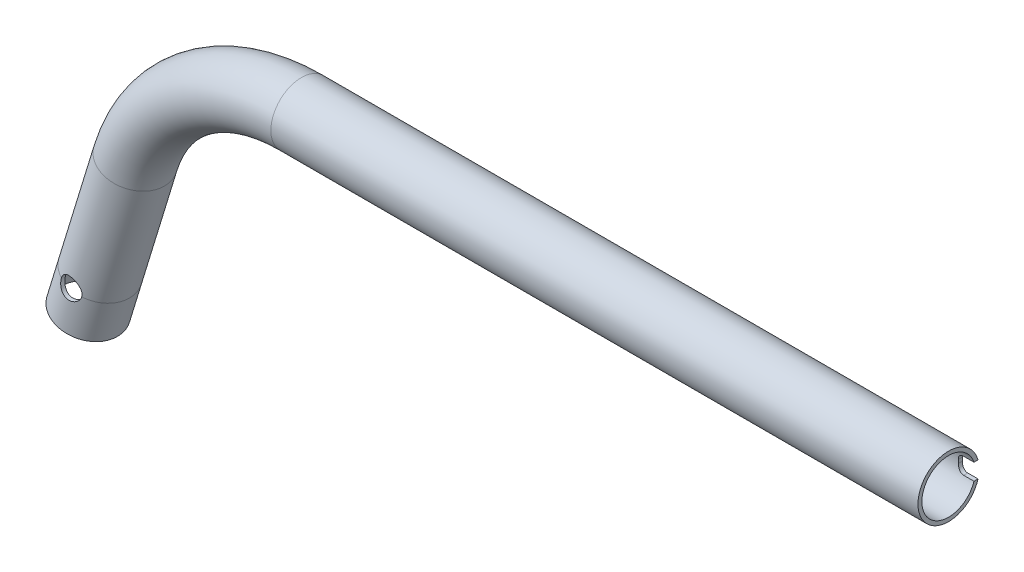
from build123d import *

# Parameters (mm, degrees)
SKETCH3_R          = 9.5
SKETCH3_R_2        = 8.3
CUT_EXTRUDE1_REACH = 191.877
SKETCH4_R          = 3.3
SKETCH5_R          = 3.3
CUT_EXTRUDE2_DEPTH = 190.876682823


with BuildPart() as part:
    # Sweep2: sweep along a path in Sketch1
    with BuildLine(Plane.XY) as sweep2_path:
        Line((108.839588828, 0), (92.239588828, 0))
        Line((92.239588828, 0), (-92.239588828, 0))
        ThreePointArc((-92.239588828, 0), (-124.360019313, -10.591729527), (-143.88004565, -38.211927945))
        Line((-143.88004565, -38.211927945), (-154.760411172, -73.8))
        Line((-154.760411172, -73.8), (-158.490325485, -86))
    # Sketch3 → Sweep2 (sweep)
    with BuildSketch(Plane(origin=(92.239588828, 0, 0), x_dir=(0, 0, -1), z_dir=(1, 0, 0))):
        Circle(SKETCH3_R)
        Circle(SKETCH3_R_2, mode=Mode.SUBTRACT)
    sweep(path=sweep2_path.line)

    # Sketch4 → Cut-Extrude1 (cut, up to next)
    with BuildSketch(Plane.XY, mode=Mode.PRIVATE) as cut_extrude1_sk1:
        with Locations((-154.760411172, -73.8)):
            Circle(SKETCH4_R)
    cut_extrude1_tool1 = extrude(cut_extrude1_sk1.sketch, amount=-CUT_EXTRUDE1_REACH, mode=Mode.PRIVATE) & part.part
    # Sketch4 → Cut-Extrude1 (cut, up to next)
    with BuildSketch(Plane.XY, mode=Mode.PRIVATE) as cut_extrude1_sk2:
        with BuildLine():
            Line((108.839588828, 2.555545653), (108.839588828, -2.555545653))
            Line((108.839588828, -2.555545653), (105.639588828, -2.555545653))
            ThreePointArc((105.639588828, -2.555545653), (104.225375266, -1.969759216), (103.639588828, -0.555545653))
            Line((103.639588828, -0.555545653), (103.639588828, 0.555545653))
            ThreePointArc((103.639588828, 0.555545653), (104.225375266, 1.969759216), (105.639588828, 2.555545653))
            Line((105.639588828, 2.555545653), (108.839588828, 2.555545653))
        make_face()
    cut_extrude1_tool2 = extrude(cut_extrude1_sk2.sketch, amount=-CUT_EXTRUDE1_REACH, mode=Mode.PRIVATE) & part.part
    # Sketch4 → Cut-Extrude1 (cut, up to next)
    with BuildSketch(Plane.XY, mode=Mode.PRIVATE) as cut_extrude1_sk3:
        with BuildLine():
            Line((90.239588828, -5.5), (94.239588828, -5.5))
            ThreePointArc((94.239588828, -5.5), (95.653802391, -4.914213562), (96.239588828, -3.5))
            Line((96.239588828, -3.5), (96.239588828, 3.5))
            ThreePointArc((96.239588828, 3.5), (95.653802391, 4.914213562), (94.239588828, 5.5))
            Line((94.239588828, 5.5), (90.239588828, 5.5))
            ThreePointArc((90.239588828, 5.5), (88.825375266, 4.914213562), (88.239588828, 3.5))
            Line((88.239588828, 3.5), (88.239588828, -3.5))
            ThreePointArc((88.239588828, -3.5), (88.825375266, -4.914213562), (90.239588828, -5.5))
        make_face()
    cut_extrude1_tool3 = extrude(cut_extrude1_sk3.sketch, amount=-CUT_EXTRUDE1_REACH, mode=Mode.PRIVATE) & part.part
    add(cut_extrude1_tool1.solids().sort_by_distance((-154.760411, -73.8, 0))[0], mode=Mode.SUBTRACT)
    add(cut_extrude1_tool2.solids().sort_by_distance((106.388287, 0, 0))[0], mode=Mode.SUBTRACT)
    add(cut_extrude1_tool3.solids().sort_by_distance((92.239589, 0, 0))[0], mode=Mode.SUBTRACT)

    # Sketch5 → Cut-Extrude2 (cut, through all)
    with BuildSketch(Plane.XY):
        with Locations((-154.760411172, -73.8)):
            Circle(SKETCH5_R)
    extrude(amount=CUT_EXTRUDE2_DEPTH, mode=Mode.SUBTRACT)


solid = part.part
